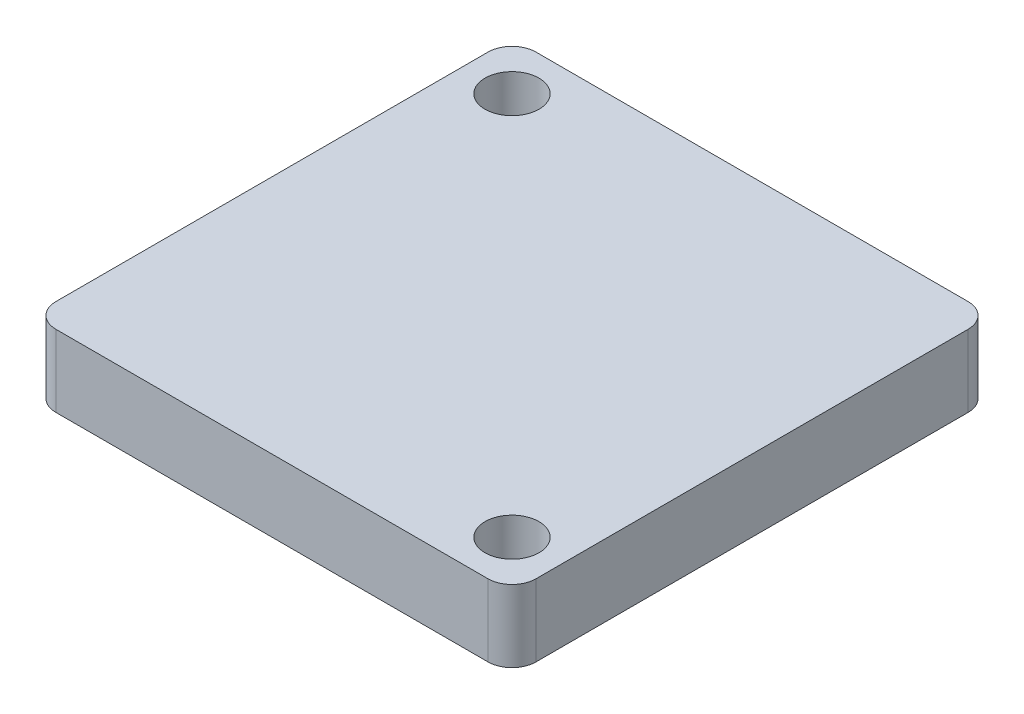
from build123d import *

# Parameters (mm, degrees)
SKETCH_1_W          = 40
SKETCH_1_H          = 6
BLOCKEXTRUDE_DEPTH  = 40
FILLET_2_R          = 2
SKETCH_2_R          = 2.25
MOUNTING_HOLE_DEPTH = 57.885850613
SKETCH_3_R          = 2.25
CUT_EXTRUDE_2_DEPTH = 57.885850613


with BuildPart() as part:
    # 草图1 → BlockExtrude (new body)
    with BuildSketch(Plane.XY):
        with Locations((20, 3)):
            Rectangle(SKETCH_1_W, SKETCH_1_H)
    extrude(amount=BLOCKEXTRUDE_DEPTH)

    # Fillet 2
    fillet_2_edges = [part.edges().sort_by_distance(p)[0] for p in [
        (40, 3, 40),
        (0, 3, 40),
        (40, 3, 0),
        (0, 3, 0),
    ]]
    fillet(fillet_2_edges, radius=FILLET_2_R)

    # 草图2 → Mounting_hole (cut, through all)
    with BuildSketch(Plane(origin=(0, 6, 0), x_dir=(1, 0, 0), z_dir=(0, 1, 0))):
        with Locations(Location((4, -4, 0), (0, 0, 270))):
            Circle(SKETCH_2_R)
    extrude(amount=-MOUNTING_HOLE_DEPTH, mode=Mode.SUBTRACT)

    # 草图3 → 切除-拉伸2 (cut, through all)
    with BuildSketch(Plane(origin=(0, 6, 0), x_dir=(1, 0, 0), z_dir=(0, 1, 0))):
        with Locations(Location((36, -36, 0), (0, 0, 270))):
            Circle(SKETCH_3_R)
    extrude(amount=-CUT_EXTRUDE_2_DEPTH, mode=Mode.SUBTRACT)


solid = part.part
